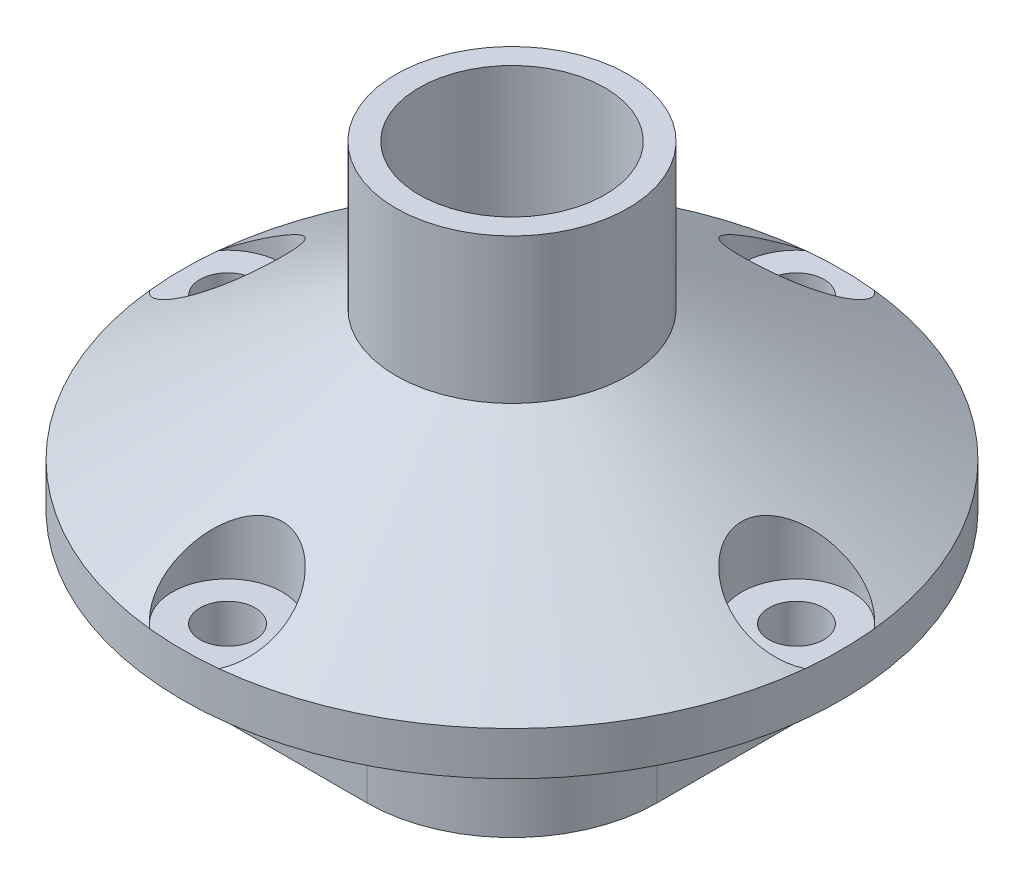
from build123d import *

# Parameters (mm, degrees)
CUT_EXTRUDE1_START = 3
SKETCH4_R          = 11.357
SKETCH4_R_2        = 0.95
CUT_EXTRUDE1_DEPTH = 3
CUT_EXTRUDE2_START = 18
SKETCH4_11_R       = 0.95
CUT_EXTRUDE2_DEPTH = 18
SKETCH5_R          = 1.9
CUT_EXTRUDE3_DEPTH = 6.875


with BuildPart() as part:
    # Sketch1 → Revolve1 (revolve)
    with BuildSketch(Plane.XY, mode=Mode.PRIVATE) as revolve1_sk:
        Polygon((-5.025, 0), (-11.357, 0), (-11.357, 4.5), (-4, 9), (-4, 14), (-3.2, 14), (-3.2, 6), (-5.025, 6), align=None)
    revolve(revolve1_sk.sketch.rotate(Axis((0, 0, 0), (0, 1, 0)), 270), axis=Axis((0, 0, 0), (0, 1, 0)))

    # Sketch4 → Cut-Extrude1 (cut)
    with BuildSketch(Plane(origin=(0, 0, 0), x_dir=(1, 0, 0), z_dir=(0, 1, 0)).offset(CUT_EXTRUDE1_START)):
        with Locations(Location((0, 0, 0), (0, 0, 90))):
            Circle(SKETCH4_R)
        with Locations(Location((-9.8035, 0, 0), (0, 0, 270))):
            Circle(SKETCH4_R_2, mode=Mode.SUBTRACT)
        with Locations(Location((0, -9.8035, 0), (0, 0, 270))):
            Circle(SKETCH4_R_2, mode=Mode.SUBTRACT)
        with BuildLine():
            ThreePointArc((-8.25, 3.25), (-6.785533906, 6.785533906), (-3.25, 8.25))
            Line((-3.25, 8.25), (0.661635478, 8.25))
            Line((0.661635478, 8.25), (3.25, 8.25))
            ThreePointArc((3.25, 8.25), (6.785533906, 6.785533906), (8.25, 3.25))
            Line((8.25, 3.25), (8.25, 0.661635478))
            Line((8.25, 0.661635478), (8.25, -3.25))
            ThreePointArc((8.25, -3.25), (6.785533906, -6.785533906), (3.25, -8.25))
            Line((3.25, -8.25), (-3.25, -8.25))
            ThreePointArc((-3.25, -8.25), (-6.785533906, -6.785533906), (-8.25, -3.25))
            Line((-8.25, -3.25), (-8.25, 0.661635478))
            Line((-8.25, 0.661635478), (-8.25, 3.25))
        make_face(mode=Mode.SUBTRACT)
        with Locations(Location((9.8035, 0, 0), (0, 0, 270))):
            Circle(SKETCH4_R_2, mode=Mode.SUBTRACT)
        with Locations(Location((0, 9.8035, 0), (0, 0, 270))):
            Circle(SKETCH4_R_2, mode=Mode.SUBTRACT)
    extrude(amount=-CUT_EXTRUDE1_DEPTH, mode=Mode.SUBTRACT)

    # Sketch4<11> → Cut-Extrude2 (cut)
    with BuildSketch(Plane(origin=(0, 0, 0), x_dir=(1, 0, 0), z_dir=(0, 1, 0)).offset(CUT_EXTRUDE2_START)):
        with Locations(Location((0, 9.8035, 0), (0, 0, 90.000000426))):
            Circle(SKETCH4_11_R)
        with Locations(Location((9.8035, 0, 0), (0, 0, 108.098639854))):
            Circle(SKETCH4_11_R)
        with Locations(Location((0, -9.8035, 0), (0, 0, 161.901360146))):
            Circle(SKETCH4_11_R)
        with Locations(Location((-9.8035, 0, 0), (0, 0, 149.382227185))):
            Circle(SKETCH4_11_R)
    extrude(amount=-CUT_EXTRUDE2_DEPTH, mode=Mode.SUBTRACT)

    # Sketch5 → Cut-Extrude3 (cut)
    with BuildSketch(Plane(origin=(0, 11.375, 0), x_dir=(1, 0, 0), z_dir=(0, 1, 0))):
        with Locations((0, 9.8125)):
            Circle(SKETCH5_R)
        with Locations((9.8125, 0)):
            Circle(SKETCH5_R)
        with Locations((0, -9.8125)):
            Circle(SKETCH5_R)
        with Locations((-9.8125, 0)):
            Circle(SKETCH5_R)
    extrude(amount=-CUT_EXTRUDE3_DEPTH, mode=Mode.SUBTRACT)


solid = part.part
